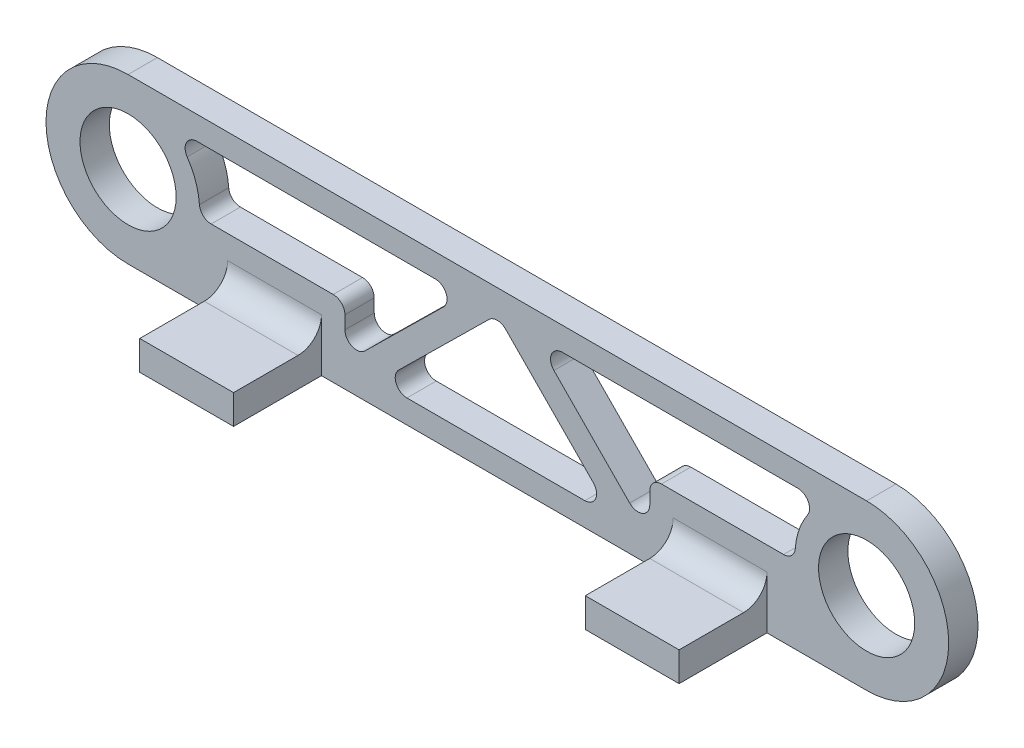
from build123d import *

# Parameters (mm, degrees)
SKETCH1_R           = 5.207
BOSS_EXTRUDE1_DEPTH = 3.175
SKETCH2_W           = 10.16
SKETCH2_H           = 3.175
BOSS_EXTRUDE2_DEPTH = 12.7
FILLET1_R           = 2.54
CUT_EXTRUDE1_DEPTH  = 51.596342012
FILLET2_R           = 1.27


with BuildPart() as part:
    # Sketch1 → Boss-Extrude1 (new body)
    with BuildSketch(Plane.XY):
        with BuildLine():
            Line((-40, 8.89), (40, 8.89))
            ThreePointArc((40, 8.89), (48.89, 0), (40, -8.89))
            Line((40, -8.89), (-40, -8.89))
            ThreePointArc((-40, -8.89), (-48.89, 0), (-40, 8.89))
        make_face()
        with Locations((-40, 0)):
            Circle(SKETCH1_R, mode=Mode.SUBTRACT)
        with Locations((40, 0)):
            Circle(SKETCH1_R, mode=Mode.SUBTRACT)
    extrude(amount=BOSS_EXTRUDE1_DEPTH)

    # Sketch2 → Boss-Extrude2 (add)
    with BuildSketch(Plane.XY):
        with Locations((24.13, -7.3025)):
            Rectangle(SKETCH2_W, SKETCH2_H)
        with Locations((-24.13, -7.3025)):
            Rectangle(SKETCH2_W, SKETCH2_H)
    extrude(amount=BOSS_EXTRUDE2_DEPTH)

    # Fillet1
    fillet1_edges = [part.edges().sort_by_distance(p)[0] for p in [
        (-24.13, -5.715, 3.175),
        (24.13, -5.715, 3.175),
    ]]
    fillet(fillet1_edges, radius=FILLET1_R)

    # Sketch3 → Cut-Extrude1 (cut, through all)
    with BuildSketch(Plane.XY.offset(3.175)):
        with BuildLine():
            Line((-31.75, -0.635), (-32.27906845, -0.635))
            ThreePointArc((-32.27906845, -0.635), (-32.98887591, 3.295473864), (-35.562263077, 6.35))
            Line((-35.562263077, 6.35), (-3.619187949, 6.35))
            Line((-3.619187949, 6.35), (-16.51, -6.35))
            Line((-16.51, -6.35), (-16.51, -0.635))
            Line((-16.51, -0.635), (-31.75, -0.635))
        make_face()
        with BuildLine():
            Line((31.75, -0.635), (32.27906845, -0.635))
            ThreePointArc((32.27906845, -0.635), (32.98887591, 3.295473864), (35.562263077, 6.35))
            Line((35.562263077, 6.35), (3.997987617, 6.35))
            Line((3.997987617, 6.35), (16.51, -6.35))
            Line((16.51, -6.35), (16.51, -0.635))
            Line((16.51, -0.635), (31.75, -0.635))
        make_face()
        Polygon((-12.890812051, -6.35), (0, 6.35), (12.512012383, -6.35), align=None)
    extrude(amount=-CUT_EXTRUDE1_DEPTH, mode=Mode.SUBTRACT)

    # Fillet2
    fillet2_edges = [part.edges().sort_by_distance(p)[0] for p in [
        (35.562263077, 6.35, 1.5875),
        (32.27906845, -0.635, 1.5875),
        (16.51, -0.635, 1.5875),
        (16.51, -6.35, 1.5875),
        (3.997987617, 6.35, 1.5875),
        (12.512012383, -6.35, 1.5875),
        (-12.890812051, -6.35, 1.5875),
        (0, 6.35, 1.5875),
        (-32.27906845, -0.635, 1.5875),
        (-35.562263077, 6.35, 1.5875),
        (-3.619187949, 6.35, 1.5875),
        (-16.51, -6.35, 1.5875),
        (-16.51, -0.635, 1.5875),
    ]]
    fillet(fillet2_edges, radius=FILLET2_R)


solid = part.part
